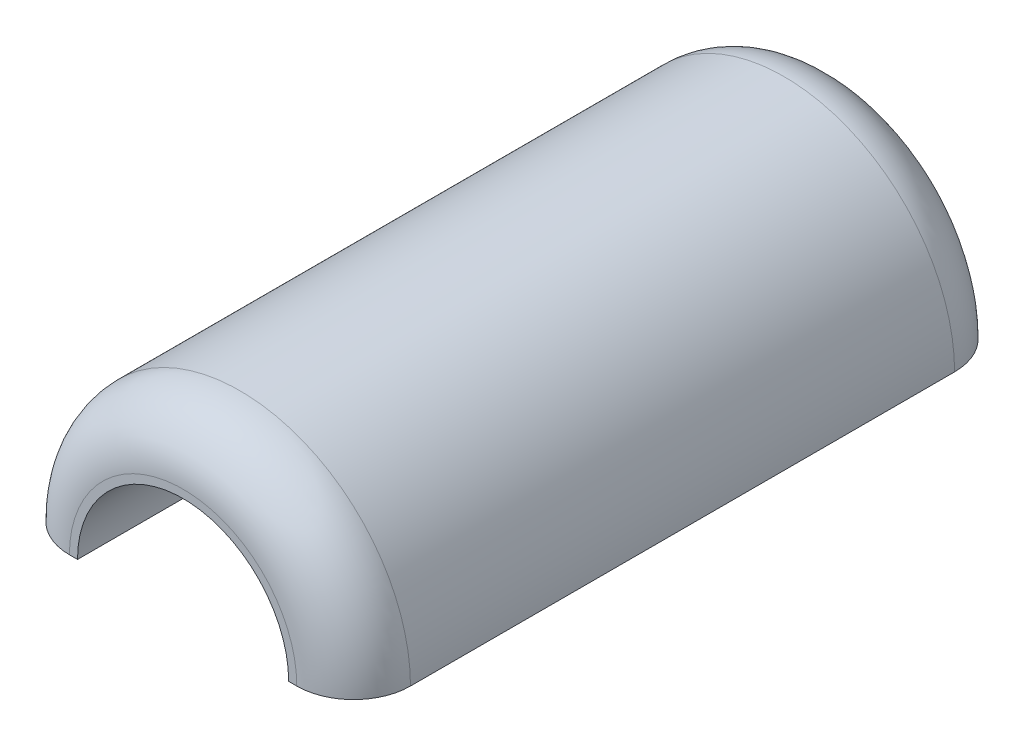
from build123d import *

# Parameters (mm, degrees)
SKETCH1_R           = 10.5
BOSS_EXTRUDE1_DEPTH = 40.5
SHELL1_T            = -4
FILLET1_R           = 3.5
FILLET2_R           = 3.5
FILLET3_R           = 1
SKETCH2_W           = 37.590072207
SKETCH2_H           = 54.748834579
CUT_EXTRUDE1_DEPTH  = 40.5


with BuildPart() as part:
    # Sketch1 → Boss-Extrude1 (new body)
    with BuildSketch(Plane.XY):
        Circle(SKETCH1_R)
    extrude(amount=BOSS_EXTRUDE1_DEPTH)

    # Shell1
    shell1_openings = [part.faces().sort_by_distance(p)[0] for p in [
        (0, 0, 40.5),
    ]]
    offset(amount=SHELL1_T, openings=shell1_openings, kind=Kind.INTERSECTION)

    # Fillet1
    fillet1_edges = [part.edges().sort_by_distance(p)[0] for p in [
        (-10.5, 0, 40.5),
    ]]
    fillet(fillet1_edges, radius=FILLET1_R)

    # Fillet2
    fillet2_edges = [part.edges().sort_by_distance(p)[0] for p in [
        (-10.5, 0, 0),
    ]]
    fillet(fillet2_edges, radius=FILLET2_R)

    # Fillet3
    fillet3_edges = [part.edges().sort_by_distance(p)[0] for p in [
        (-6.5, 0, 4),
    ]]
    fillet(fillet3_edges, radius=FILLET3_R)

    # Sketch2 → Cut-Extrude1 (cut)
    with BuildSketch(Plane(origin=(0, 0, 0), x_dir=(1, 0, 0), z_dir=(0, 1, 0))):
        with Locations((0.840248673, -18.259937353)):
            Rectangle(SKETCH2_W, SKETCH2_H)
    extrude(amount=-CUT_EXTRUDE1_DEPTH, mode=Mode.SUBTRACT)


solid = part.part
